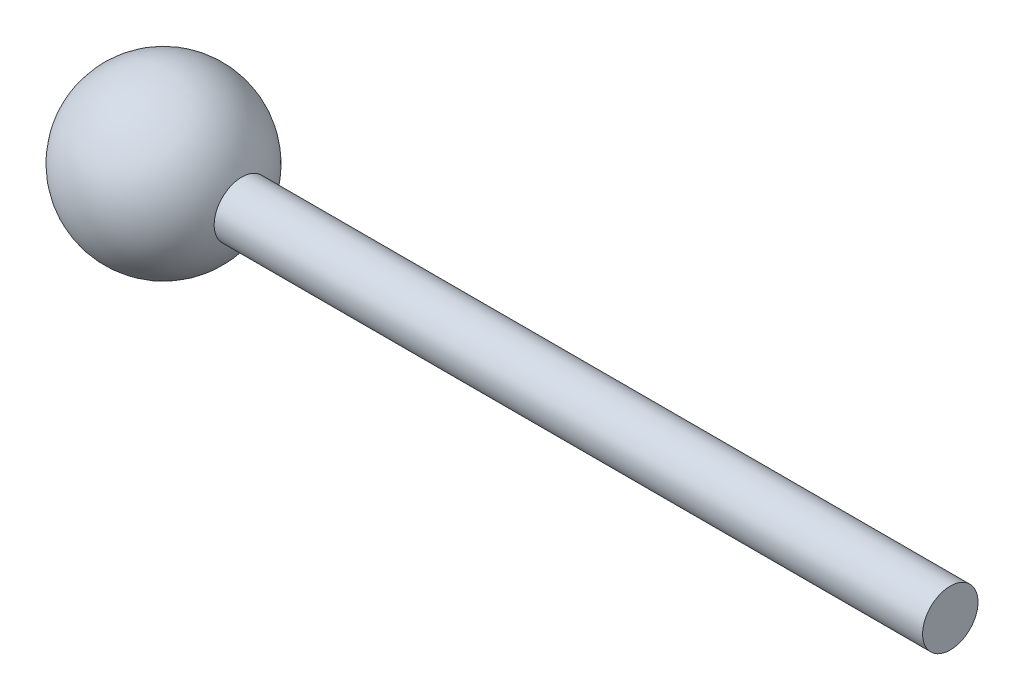
from build123d import *

# Parameters (mm, degrees)
SKETCH2_R           = 6.35
BOSS_EXTRUDE1_DEPTH = 180.34


with BuildPart() as part:
    # Sketch1 → Revolve1 (revolve)
    with BuildSketch(Plane.XY):
        with BuildLine():
            Line((-19.05, 0), (19.05, 0))
            ThreePointArc((19.05, 0), (0, 19.05), (-19.05, 0))
        make_face()
    revolve(axis=Axis((-19.05, 0, 0), (1, 0, 0)))

    # Sketch2 → Boss-Extrude1 (add)
    with BuildSketch(Plane(origin=(0, 0, 0), x_dir=(0, 0, -1), z_dir=(1, 0, 0))):
        with Locations(Location((0, 0, 0), (0, 0, 180))):
            Circle(SKETCH2_R)
    extrude(amount=BOSS_EXTRUDE1_DEPTH)


solid = part.part
